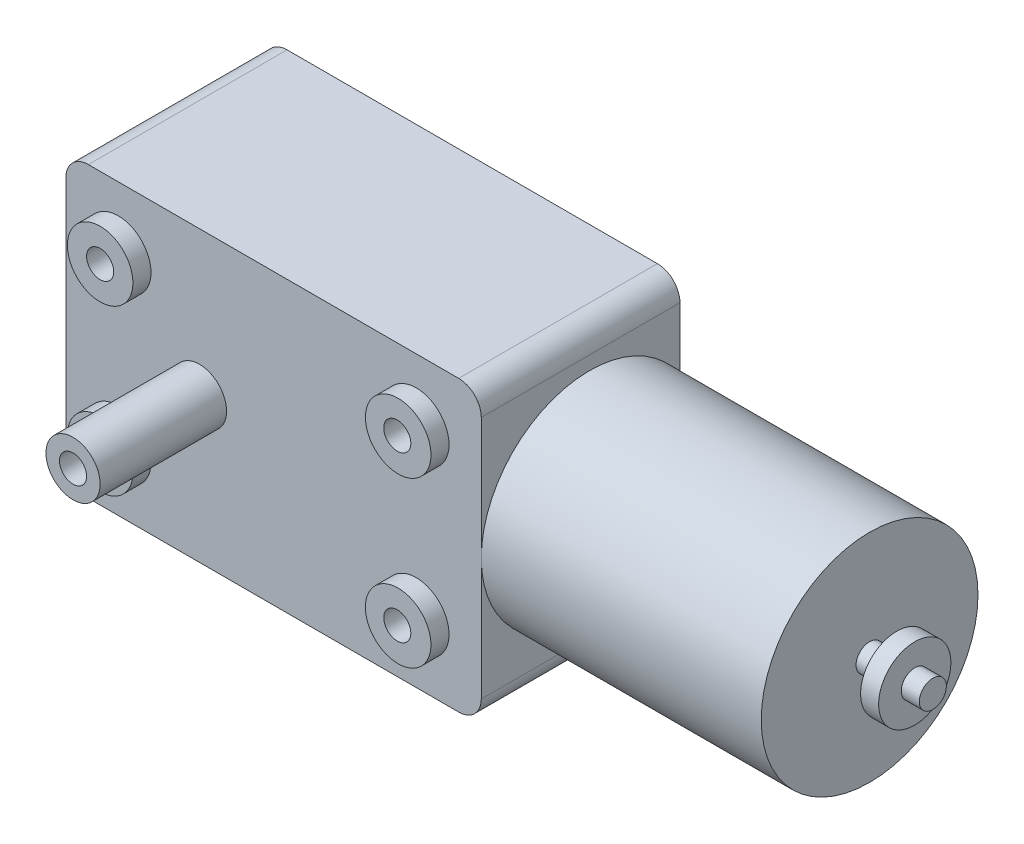
from build123d import *

# Parameters (mm, degrees)
BOSS_EXTRUDE1_DEPTH = 22
SKETCH2_R           = 3
BOSS_EXTRUDE2_DEPTH = 14
SKETCH5_R           = 3.63
BOSS_EXTRUDE3_DEPTH = 2
SKETCH7_R           = 1.5
CUT_EXTRUDE1_DEPTH  = 3.5
SKETCH8_R           = 12
BOSS_EXTRUDE4_DEPTH = 31
SKETCH9_R           = 1.5
BOSS_EXTRUDE5_DEPTH = 7
SKETCH10_R          = 4
BOSS_EXTRUDE6_DEPTH = 2
SKETCH11_R          = 1.5
CUT_EXTRUDE2_DEPTH  = 3.5


with BuildPart() as part:
    # Sketch1 → Boss-Extrude1 (new body)
    with BuildSketch(Plane.XY):
        with BuildLine():
            Line((-20.5, -16), (20.5, -16))
            ThreePointArc((20.5, -16), (22.267766953, -15.267766953), (23, -13.5))
            Line((23, -13.5), (23, 13.5))
            ThreePointArc((23, 13.5), (22.267766953, 15.267766953), (20.5, 16))
            Line((20.5, 16), (-20.5, 16))
            ThreePointArc((-20.5, 16), (-22.267766953, 15.267766953), (-23, 13.5))
            Line((-23, 13.5), (-23, -13.5))
            ThreePointArc((-23, -13.5), (-22.267766953, -15.267766953), (-20.5, -16))
        make_face()
    extrude(amount=BOSS_EXTRUDE1_DEPTH)

    # Sketch2 → Boss-Extrude2 (add)
    with BuildSketch(Plane.XY.offset(22)):
        with Locations((-8.2, 0)):
            Circle(SKETCH2_R)
    extrude(amount=BOSS_EXTRUDE2_DEPTH)

    # Sketch5 → Boss-Extrude3 (add)
    with BuildSketch(Plane.XY.offset(22)):
        with Locations((-17.2, 9.11)):
            Circle(SKETCH5_R)
        with Locations((-17.2, -9.09)):
            Circle(SKETCH5_R)
        with Locations((15.8, 9.11)):
            Circle(SKETCH5_R)
        with Locations((15.8, -9.09)):
            Circle(SKETCH5_R)
    extrude(amount=BOSS_EXTRUDE3_DEPTH)

    # Sketch7 → Cut-Extrude1 (cut)
    with BuildSketch(Plane.XY.offset(24)):
        with Locations((-17.2, 9.11)):
            Circle(SKETCH7_R)
        with Locations((-17.2, -9.09)):
            Circle(SKETCH7_R)
        with Locations((15.7, 9.11)):
            Circle(SKETCH7_R)
        with Locations((15.7, -9.09)):
            Circle(SKETCH7_R)
    extrude(amount=-CUT_EXTRUDE1_DEPTH, mode=Mode.SUBTRACT)

    # Sketch8 → Boss-Extrude4 (add)
    with BuildSketch(Plane(origin=(23, 0, 0), x_dir=(0, 0, -1), z_dir=(1, 0, 0))):
        with Locations(Location((-10, 0, 0), (0, 0, 180))):
            Circle(SKETCH8_R)
    extrude(amount=BOSS_EXTRUDE4_DEPTH)

    # Sketch9 → Boss-Extrude5 (add)
    with BuildSketch(Plane(origin=(54, 0, 0), x_dir=(0, 0, -1), z_dir=(1, 0, 0))):
        with Locations((-10, 0)):
            Circle(SKETCH9_R)
    extrude(amount=BOSS_EXTRUDE5_DEPTH)

    # Sketch10 → Boss-Extrude6 (add)
    with BuildSketch(Plane(origin=(57, 0, 0), x_dir=(0, 0, -1), z_dir=(1, 0, 0))):
        with Locations((-10, 0)):
            Circle(SKETCH10_R)
    extrude(amount=BOSS_EXTRUDE6_DEPTH)

    # Sketch11 → Cut-Extrude2 (cut)
    with BuildSketch(Plane.XY.offset(36)):
        with Locations((-8.2, 0)):
            Circle(SKETCH11_R)
    extrude(amount=-CUT_EXTRUDE2_DEPTH, mode=Mode.SUBTRACT)


solid = part.part
